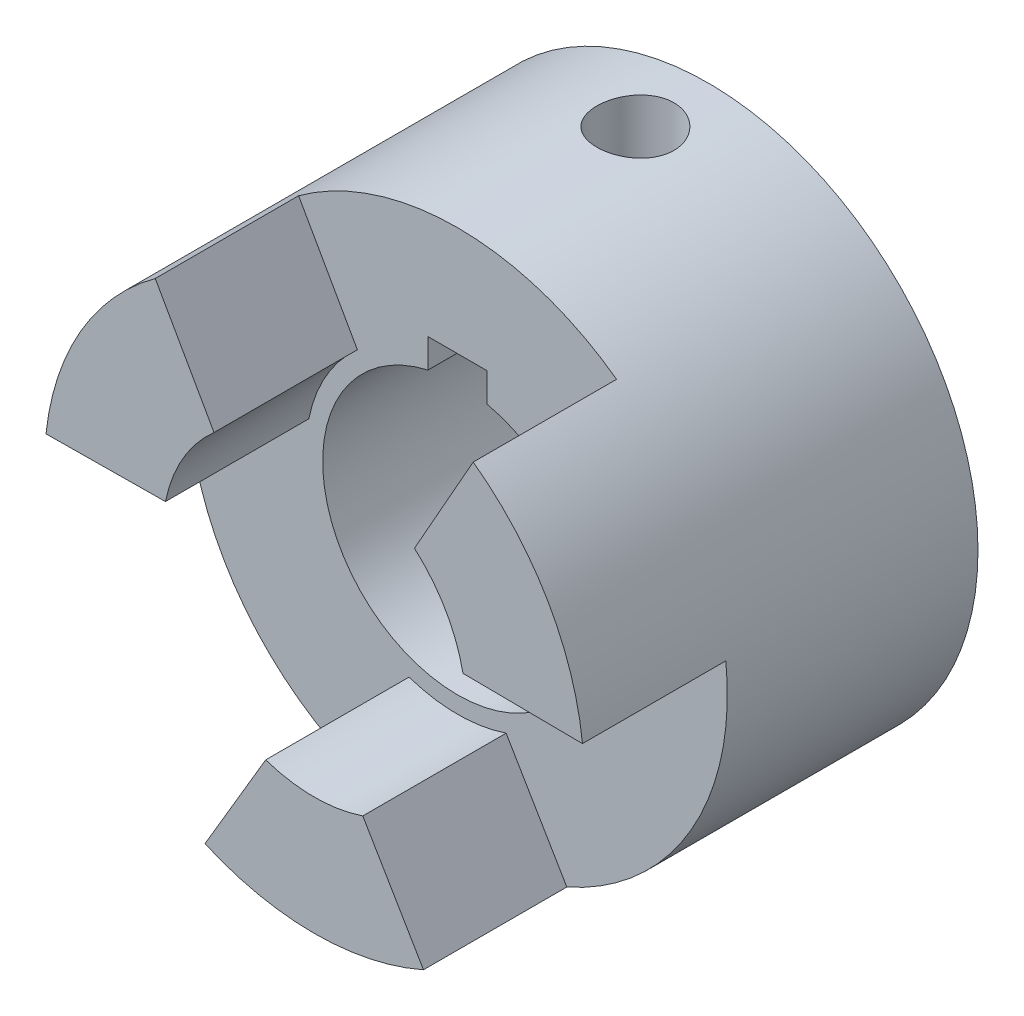
from build123d import *

# Parameters (mm, degrees)
SZKIC1_R                    = 22.225
DODANIE_WYCI_GNI_CIE1_DEPTH = 20.65
WYTNIJ_WYCI_GNI_CIE1_REACH  = 39.607
DODANIE_WYCI_GNI_CIE2_DEPTH = 11.81
SZYK_KO_OWY1_COUNT          = 3
SZKIC4_R                    = 3.175
WYTNIJ_WYCI_GNI_CIE2_DEPTH  = 6.54


with BuildPart() as part:
    # Szkic1 → Dodanie-wyciągnięcie1 (new body)
    with BuildSketch(Plane.XY):
        with Locations(Location((0, 0, 0), (0, 0, 180))):
            Circle(SZKIC1_R)
    extrude(amount=DODANIE_WYCI_GNI_CIE1_DEPTH)

    # Szkic2 → Wytnij-wyciągnięcie1 (cut, up to next)
    with BuildSketch(Plane.XY.offset(20.65), mode=Mode.PRIVATE) as wytnij_wyci_gni_cie1_sk1:
        with BuildLine():
            Line((-2.44, 13.233874999), (2.44, 13.233874999))
            Line((2.44, 13.233874999), (2.44, 10.843874999))
            ThreePointArc((2.44, 10.843874999), (0, -11.115), (-2.44, 10.843874999))
            Line((-2.44, 10.843874999), (-2.44, 13.233874999))
        make_face()
    wytnij_wyci_gni_cie1_tool1 = extrude(wytnij_wyci_gni_cie1_sk1.sketch, amount=-WYTNIJ_WYCI_GNI_CIE1_REACH, mode=Mode.PRIVATE) & part.part
    add(wytnij_wyci_gni_cie1_tool1.solids().sort_by_distance((0, 0.327718, 20.65))[0], mode=Mode.SUBTRACT)

    # Szkic3 → Dodanie-wyciągnięcie2 (add)
    with BuildSketch(Plane.XY.offset(20.65)):
        with BuildLine():
            ThreePointArc((0, -12.5), (-2.026821276, -12.33458534), (-4, -11.842719282))
            Line((-4, -11.842719282), (-9, -20.321186604))
            ThreePointArc((-9, -20.321186604), (-4.599578933, -21.743838176), (0, -22.225))
            Line((0, -22.225), (0, -12.5))
        make_face()
        with BuildLine():
            ThreePointArc((4, -11.842719282), (2.026821276, -12.33458534), (0, -12.5))
            Line((0, -12.5), (0, -22.225))
            ThreePointArc((0, -22.225), (4.599578933, -21.743838176), (9, -20.321186604))
            Line((9, -20.321186604), (4, -11.842719282))
        make_face()
    dodanie_wyci_gni_cie2 = extrude(amount=DODANIE_WYCI_GNI_CIE2_DEPTH)

    # Szyk kołowy1: Dodanie-wyciągnięcie2 ×3 about axis
    szyk_ko_owy1_axis = Axis((0, 0, 0), (0, 0, 1))
    for i in range(1, SZYK_KO_OWY1_COUNT):
        add(dodanie_wyci_gni_cie2.rotate(szyk_ko_owy1_axis, i * 360 / SZYK_KO_OWY1_COUNT))

    # Szkic4 → Wytnij-wyciągnięcie2 (cut)
    with BuildSketch(Plane(origin=(0, 22.225, 0), x_dir=(1, 0, 0), z_dir=(0, 1, 0))):
        with Locations(Location((0, -6, 0), (0, 0, 270))):
            Circle(SZKIC4_R)
    extrude(amount=-WYTNIJ_WYCI_GNI_CIE2_DEPTH, mode=Mode.SUBTRACT)


solid = part.part
